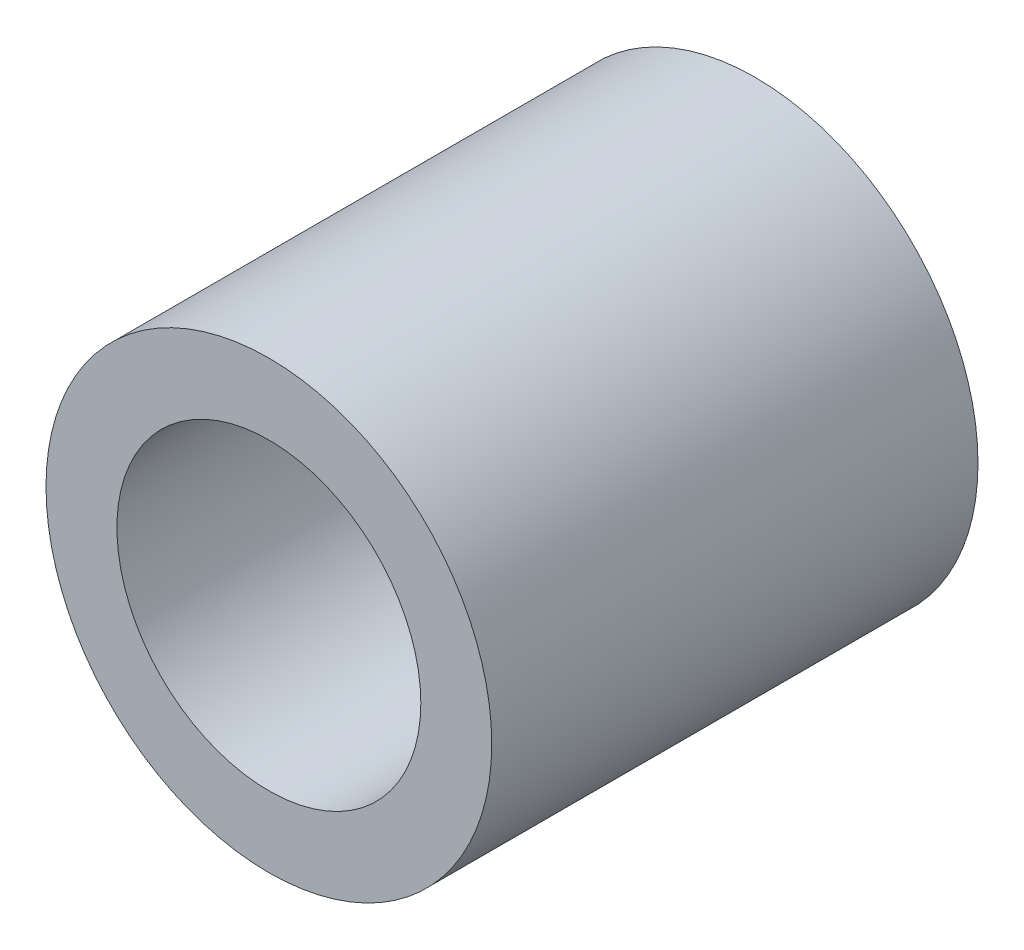
from build123d import *

# Parameters (mm, degrees)
SKETCH1_R           = 11
SKETCH1_R_2         = 7.5
BOSS_EXTRUDE1_DEPTH = 24


with BuildPart() as part:
    # Sketch1 → Boss-Extrude1 (new body)
    with BuildSketch(Plane.XY):
        Circle(SKETCH1_R)
        Circle(SKETCH1_R_2, mode=Mode.SUBTRACT)
    extrude(amount=BOSS_EXTRUDE1_DEPTH)


solid = part.part
